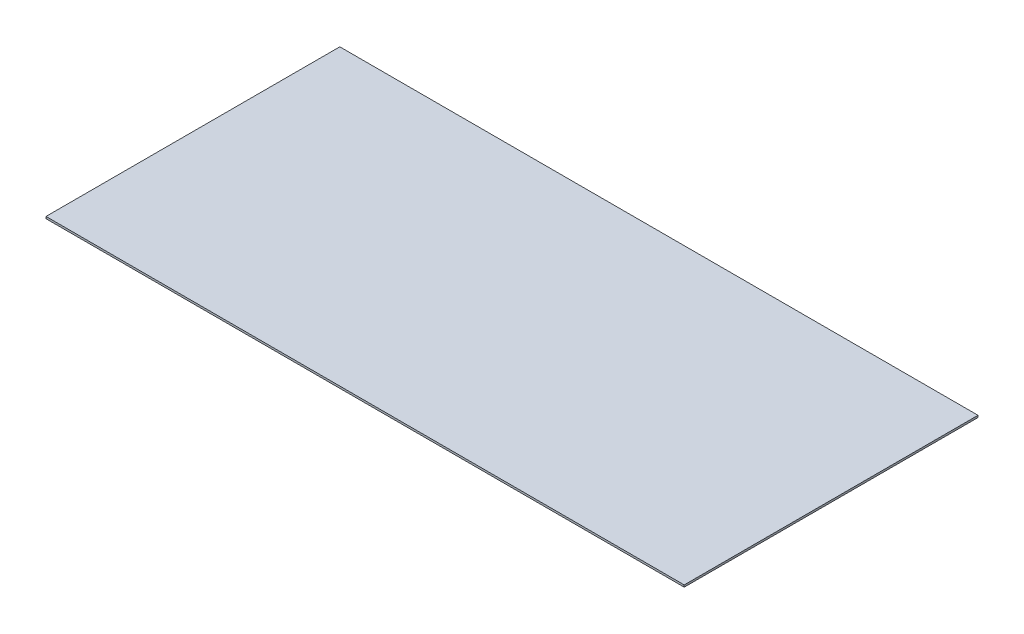
from build123d import *

# Parameters (mm, degrees)
SKETCH1_W           = 320.04
SKETCH1_H           = 147.32
BOSS_EXTRUDE1_DEPTH = 1


with BuildPart() as part:
    # Sketch1 → Boss-Extrude1 (new body)
    with BuildSketch(Plane(origin=(0, 0, 0), x_dir=(1, 0, 0), z_dir=(0, 1, 0))):
        with Locations((160.02, 73.66)):
            Rectangle(SKETCH1_W, SKETCH1_H)
    extrude(amount=BOSS_EXTRUDE1_DEPTH)


solid = part.part
